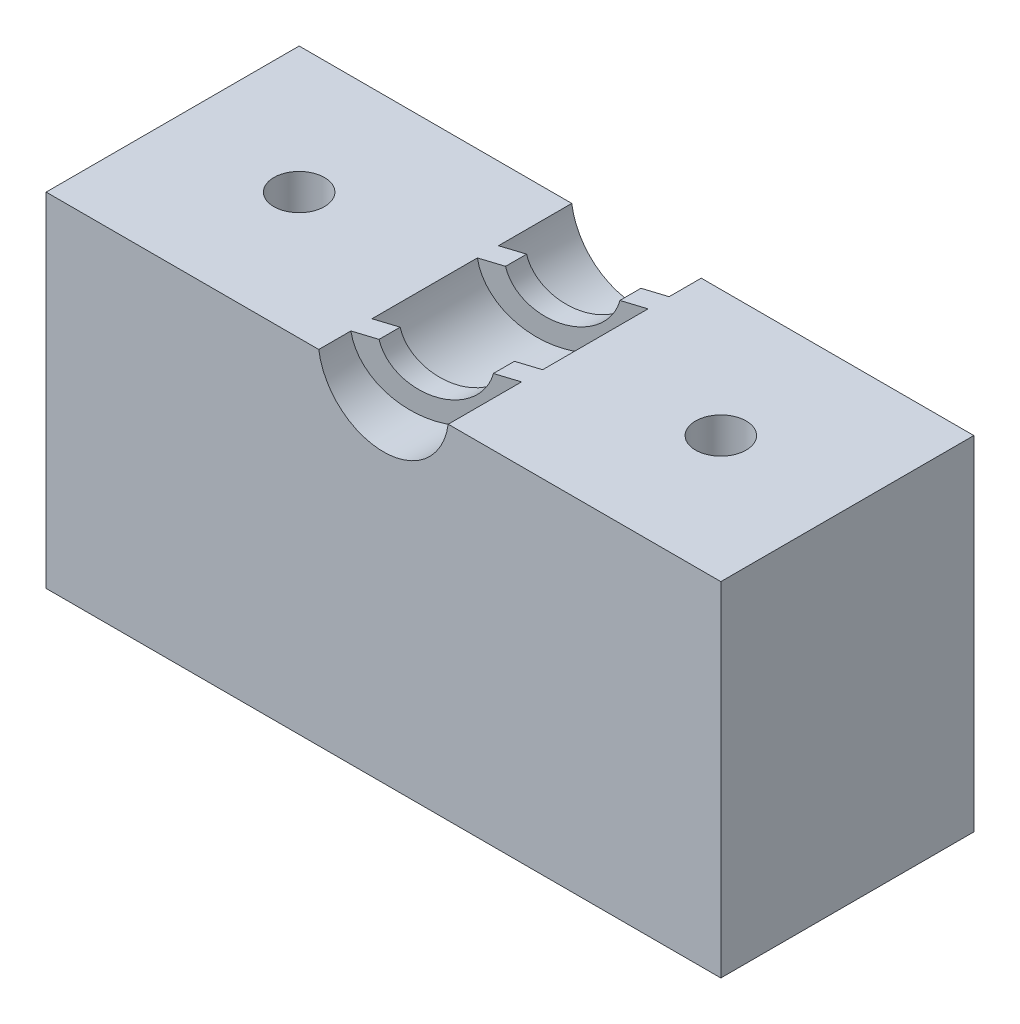
from build123d import *

# Parameters (mm, degrees)
SKETCH_1_W               = 16
SKETCH_1_H               = 16
SKETCH_1_R               = 1.55
EXTRUDE_1_DEPTH          = 3
EXTRUDE_2_DEPTH          = 8
CUT_EXTRUDE_2_DEPTH      = 12.704699911
CUT_EXTRUDE_2_DEPTH_BACK = 12.704699911
SKETCH_8_R               = 0.6
CUT_EXTRUDE_3_DEPTH      = 12.704699911
SKETCH_9_W               = 16
SKETCH_9_H               = 6
SKETCH_9_R               = 0.6
EXTRUDE_3_DEPTH          = 0.355


with BuildPart() as part:
    # 草图1 → 凸台-拉伸1 (new, symmetric)
    with BuildSketch(Plane.XY):
        Rectangle(SKETCH_1_W, SKETCH_1_H)
        Circle(SKETCH_1_R, mode=Mode.SUBTRACT)
    extrude(amount=EXTRUDE_1_DEPTH, both=True)

    # 草图6 → 凸台-拉伸2 (add)
    with BuildSketch(Plane(origin=(0, 0, 0), x_dir=(1, 0, 0), z_dir=(0, 1, 0))):
        Polygon((-1.55, -1.743476048), (-1.55, -2.243476048), (1.55, -1.256523952), (1.55, -0.756523952), align=None)
        Polygon((-1.55, 1.256523952), (-1.55, 0.756523952), (1.55, 1.743476048), (1.55, 2.243476048), align=None)
    extrude(amount=-EXTRUDE_2_DEPTH)

    # 草图7 → 切除-拉伸2 (cut, two sides: drawn at the far end of the back side and taken through both)
    with BuildSketch(Plane.XY.offset(-CUT_EXTRUDE_2_DEPTH_BACK)):
        with BuildLine():
            Line((-8, -0.214092961), (-1.027941732, -0.214092961))
            ThreePointArc((-1.027941732, -0.214092961), (-0.107613153, 1.044470875), (1.05, 0))
            ThreePointArc((1.05, 0), (1.044470875, -0.107613153), (1.027941732, -0.214092961))
            Line((1.027941732, -0.214092961), (8, -0.214092961))
            Line((8, -0.214092961), (8, 8))
            Line((8, 8), (-8, 8))
            Line((-8, 8), (-8, -0.214092961))
        make_face()
        with BuildLine():
            Line((1.027941732, -0.214092961), (0, 0))
            Line((0, 0), (-1.027941732, -0.214092961))
            ThreePointArc((-1.027941732, -0.214092961), (0, -1.05), (1.027941732, -0.214092961))
        make_face()
        with BuildLine():
            Line((-1.027941732, -0.214092961), (0, 0))
            Line((0, 0), (1.027941732, -0.214092961))
            ThreePointArc((1.027941732, -0.214092961), (1.044470875, -0.107613153), (1.05, 0))
            ThreePointArc((1.05, 0), (-0.107613153, 1.044470875), (-1.027941732, -0.214092961))
        make_face()
    extrude(amount=CUT_EXTRUDE_2_DEPTH + CUT_EXTRUDE_2_DEPTH_BACK, mode=Mode.SUBTRACT)

    # 草图8 → 切除-拉伸3 (cut, through all)
    with BuildSketch(Plane(origin=(0, 0, 0), x_dir=(1, 0, 0), z_dir=(0, 1, 0))):
        with Locations(Location((-5, 0, 0), (0, 0, 270))):
            Circle(SKETCH_8_R)
        with Locations(Location((5, 0, 0), (0, 0, 270))):
            Circle(SKETCH_8_R)
    extrude(amount=-CUT_EXTRUDE_3_DEPTH, mode=Mode.SUBTRACT)

    # 草图9 → 凸台-拉伸3 (add)
    with BuildSketch(Plane.XZ.offset(8)):
        Rectangle(SKETCH_9_W, SKETCH_9_H)
        with Locations(Location((-5, 0, 0), (0, 0, 180))):
            Circle(SKETCH_9_R, mode=Mode.SUBTRACT)
        with Locations((5, 0)):
            Circle(SKETCH_9_R, mode=Mode.SUBTRACT)
    extrude(amount=EXTRUDE_3_DEPTH)


solid = part.part
